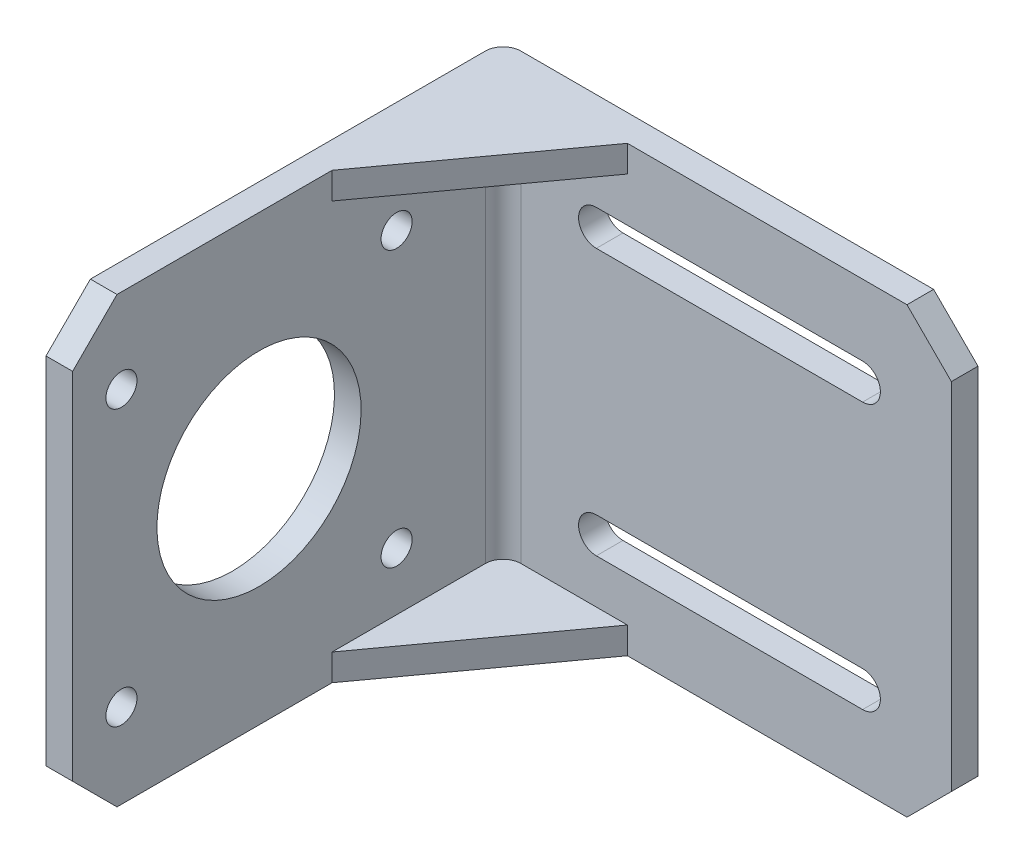
from build123d import *

# Parameters (mm, degrees)
SKETCH2_W           = 53.5
SKETCH2_H           = 50
BOSS_EXTRUDE1_DEPTH = 51.5
SKETCH3_W           = 50.5
SKETCH3_H           = 50
CUT_EXTRUDE1_DEPTH  = 48.5
CHAMFER1_SIZE       = 14
CHAMFER1_SIZE2      = 19.269346887
SKETCH4_W           = 48.5
SKETCH4_H           = 44
CUT_EXTRUDE2_DEPTH  = 50.5
SKETCH5_R           = 1.75
SKETCH5_R_2         = 11.5
CUT_EXTRUDE3_DEPTH  = 10
CUT_EXTRUDE4_DEPTH  = 10
CHAMFER2_SIZE       = 5
FILLET1_R           = 2


with BuildPart() as part:
    # Sketch2 → Boss-Extrude1 (new body)
    with BuildSketch(Plane.XY):
        Rectangle(SKETCH2_W, SKETCH2_H)
    extrude(amount=BOSS_EXTRUDE1_DEPTH)

    # Sketch3 → Cut-Extrude1 (cut)
    with BuildSketch(Plane.XY.offset(51.5)):
        with Locations((1.5, 0)):
            Rectangle(SKETCH3_W, SKETCH3_H)
    extrude(amount=-CUT_EXTRUDE1_DEPTH, mode=Mode.SUBTRACT)

    # Chamfer1
    chamfer1_edges = [part.edges().sort_by_distance(p)[0] for p in [
        (-23.75, 0, 3),
    ]]
    chamfer1_side = [part.faces().sort_by_distance(p)[0] for p in [
        (1.5, 0, 3),
    ]]
    chamfer(chamfer1_edges, length=CHAMFER1_SIZE, length2=CHAMFER1_SIZE2, reference=chamfer1_side[0])

    # Sketch4 → Cut-Extrude2 (cut)
    with BuildSketch(Plane(origin=(26.75, 0, 0), x_dir=(0, 0, -1), z_dir=(1, 0, 0))):
        with Locations((-27.25, 0)):
            Rectangle(SKETCH4_W, SKETCH4_H)
    extrude(amount=-CUT_EXTRUDE2_DEPTH, mode=Mode.SUBTRACT)

    # Sketch5 → Cut-Extrude3 (cut)
    with BuildSketch(Plane.ZY.offset(26.75)):
        with Locations(Location((46, 15.5, 0), (0, 0, 270))):
            Circle(SKETCH5_R)
        with Locations(Location((46, -15.5, 0), (0, 0, 270))):
            Circle(SKETCH5_R)
        with Locations(Location((15, 15.5, 0), (0, 0, 270))):
            Circle(SKETCH5_R)
        with Locations(Location((15, -15.5, 0), (0, 0, 270))):
            Circle(SKETCH5_R)
        with Locations(Location((30.5, 0, 0), (0, 0, 270))):
            Circle(SKETCH5_R_2)
    extrude(amount=-CUT_EXTRUDE3_DEPTH, mode=Mode.SUBTRACT)

    # Sketch6 → Cut-Extrude4 (cut)
    with BuildSketch(Plane.XY.offset(3)):
        with BuildLine():
            Line((-13.25, 17), (16.75, 17))
            ThreePointArc((16.75, 17), (18.75, 15), (16.75, 13))
            Line((16.75, 13), (-13.25, 13))
            ThreePointArc((-13.25, 13), (-15.25, 15), (-13.25, 17))
        make_face()
        with BuildLine():
            Line((-13.25, -13), (16.75, -13))
            ThreePointArc((16.75, -13), (18.75, -15), (16.75, -17))
            Line((16.75, -17), (-13.25, -17))
            ThreePointArc((-13.25, -17), (-15.25, -15), (-13.25, -13))
        make_face()
    extrude(amount=-CUT_EXTRUDE4_DEPTH, mode=Mode.SUBTRACT)

    # Chamfer2
    chamfer2_edges = [part.edges().sort_by_distance(p)[0] for p in [
        (-25.25, -25, 51.5),
        (-25.25, 25, 51.5),
        (26.75, -25, 1.5),
        (26.75, 25, 1.5),
    ]]
    chamfer(chamfer2_edges, length=CHAMFER2_SIZE)

    # Fillet1
    fillet1_edges = [part.edges().sort_by_distance(p)[0] for p in [
        (-23.75, 0, 3),
        (-26.75, 0, 0),
    ]]
    fillet(fillet1_edges, radius=FILLET1_R)


solid = part.part
